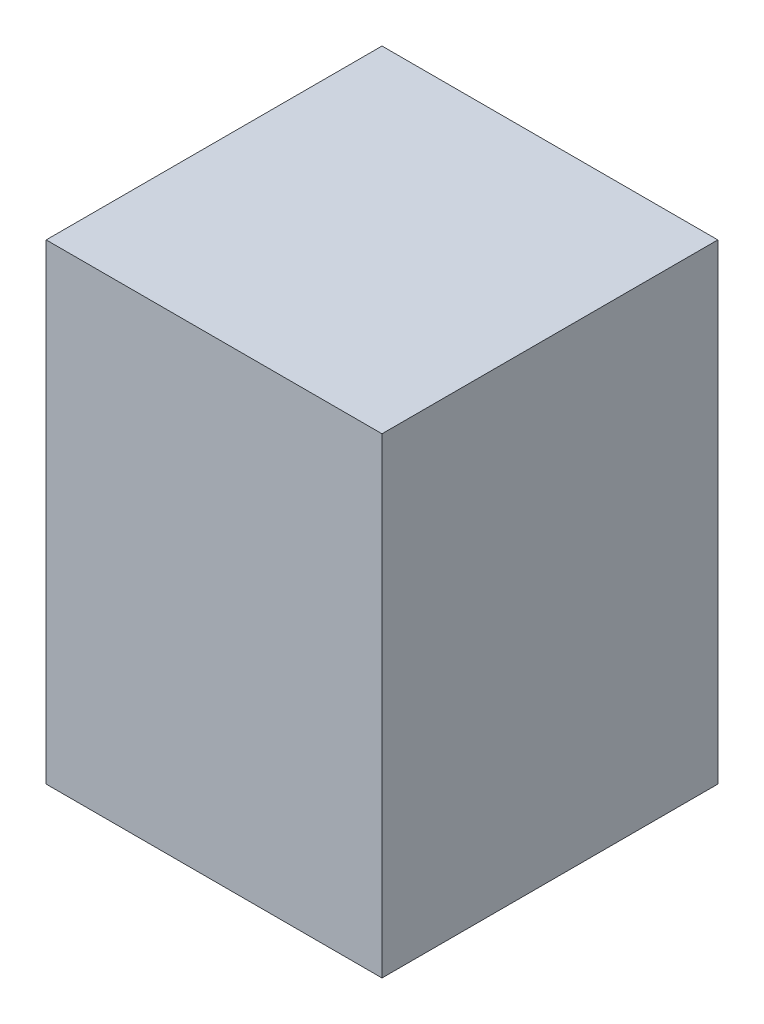
from build123d import *

# Parameters (mm, degrees)
PACK_STEP_MOTOR_NEMA23_3NM_1_START = -373
SKETCH1_W                          = 57
SKETCH1_H                          = 80
PACK_STEP_MOTOR_NEMA23_3NM_1_DEPTH = 57


with BuildPart() as part:
    # Sketch1 → PACK_step_motor_NEMA23_3Nm_1 (new body)
    with BuildSketch(Plane.XY.offset(PACK_STEP_MOTOR_NEMA23_3NM_1_START)):
        with Locations((350.5, 340)):
            Rectangle(SKETCH1_W, SKETCH1_H)
    extrude(amount=-PACK_STEP_MOTOR_NEMA23_3NM_1_DEPTH)


solid = part.part
